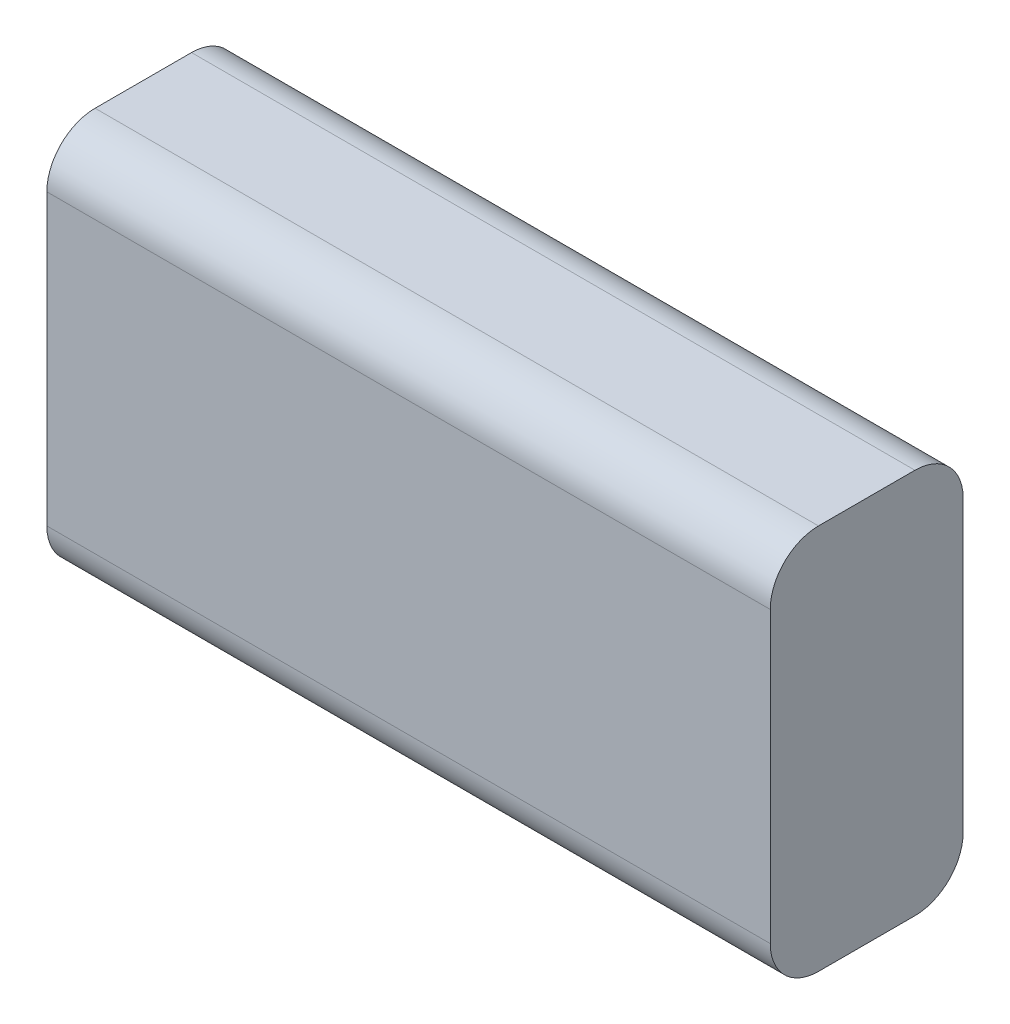
from build123d import *

# Parameters (mm, degrees)
CROQUIS1_W              = 75
CROQUIS1_H              = 40
SALIENTE_EXTRUIR1_DEPTH = 20
REDONDEO1_R             = 5


with BuildPart() as part:
    # Croquis1 → Saliente-Extruir1 (new body)
    with BuildSketch(Plane.XY):
        Rectangle(CROQUIS1_W, CROQUIS1_H)
    extrude(amount=SALIENTE_EXTRUIR1_DEPTH)

    # Redondeo1
    redondeo1_edges = [part.edges().sort_by_distance(p)[0] for p in [
        (0, -20, 20),
        (0, -20, 0),
        (0, 20, 0),
        (0, 20, 20),
    ]]
    fillet(redondeo1_edges, radius=REDONDEO1_R)


solid = part.part
